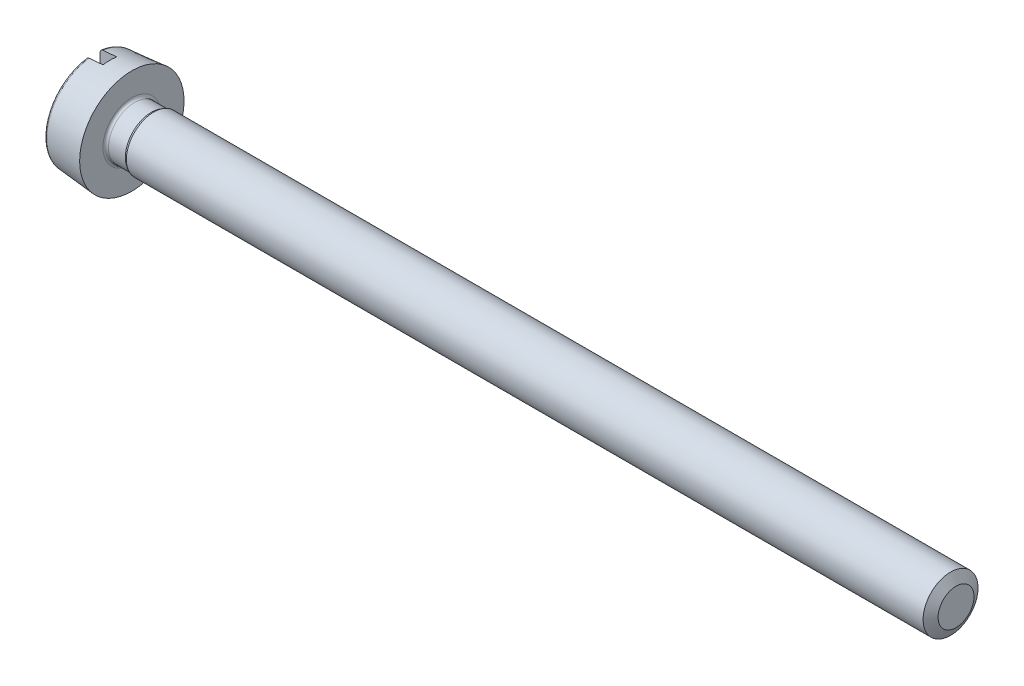
from build123d import *

# Parameters (mm, degrees)
CUT_EXTRUDE_1_DEPTH = 0.6


with BuildPart() as part:
    # 草图1 → Revolve 651 (revolve)
    with BuildSketch(Plane.XY, mode=Mode.PRIVATE) as revolve_651_sk:
        with BuildLine():
            Line((0, 0), (0, 1.685882754))
            ThreePointArc((0, 1.685882754), (0.026272266, 1.753441774), (0.091284426, 1.785502223))
            Line((0.091284426, 1.785502223), (1.4, 1.9))
            Line((1.4, 1.9), (1.4, 1.05))
            ThreePointArc((1.4, 1.05), (1.429289322, 0.979289322), (1.5, 0.95))
            Line((1.5, 0.95), (2.11339746, 0.95))
            Line((2.11339746, 0.95), (2.2, 1))
            Line((2.2, 1), (31.4, 1))
            Line((31.4, 1), (31.4, 0))
            Line((31.4, 0), (0, 0))
        make_face()
    revolve(revolve_651_sk.sketch.rotate(Axis((0, 0, 0), (1, 0, 0)), 90), axis=Axis((0, 0, 0), (1, 0, 0)))

    # 草图2 → 切除-拉伸1 (cut)
    with BuildSketch(Plane.ZY):
        with BuildLine():
            Line((0.25, 1.88348082), (0.25, -1.88348082))
            ThreePointArc((0.25, -1.88348082), (0, -1.9), (-0.25, -1.88348082))
            Line((-0.25, -1.88348082), (-0.25, 1.88348082))
            ThreePointArc((-0.25, 1.88348082), (0, 1.9), (0.25, 1.88348082))
        make_face()
    extrude(amount=-CUT_EXTRUDE_1_DEPTH, mode=Mode.SUBTRACT)

    # 草图3 → 切除-旋转1 (revolve, cut)
    with BuildSketch(Plane(origin=(0, 0, 0), x_dir=(1, 0, 0), z_dir=(0, 1, 0)), mode=Mode.PRIVATE) as cut_revolve_1_sk:
        Polygon((31.200005867, 1), (31.599994133, 1), (31.4, 0.6536), align=None)
    revolve(cut_revolve_1_sk.sketch.rotate(Axis((0, 0, 0), (1, 0, 0)), 180), axis=Axis((0, 0, 0), (1, 0, 0)), mode=Mode.SUBTRACT)


solid = part.part
